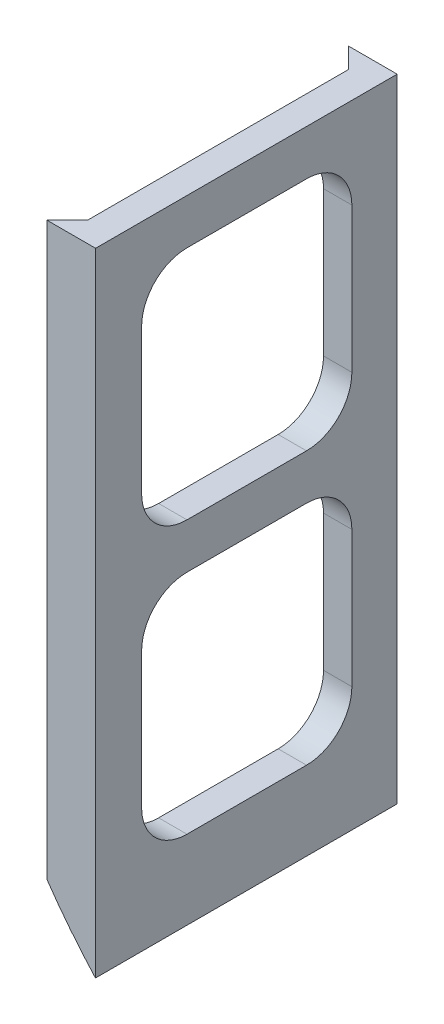
from build123d import *

# Parameters (mm, degrees)
BOSS_EXTRU_1_DEPTH           = 23
BOSS_EXTRU_2_DEPTH           = 55.74
ENL_V_MAT_EXTRU_2_DEPTH      = 166.850257131
ENL_V_MAT_EXTRU_2_DEPTH_BACK = 166.850257131
ENL_V_MAT_EXTRU_3_DEPTH      = 172.327320122
ENL_V_MAT_EXTRU_3_DEPTH_BACK = 172.327320122


with BuildPart() as part:
    # Esquisse1 → Boss.-Extru.1 (new body)
    with BuildSketch(Plane.XY):
        with BuildLine():
            Line((39.457988868, 163.966514235), (39.457988868, 111.179894524))
            ThreePointArc((39.457988868, 111.179894524), (40.679417093, 109.678629524), (41.957988868, 108.225722877))
            Line((41.957988868, 108.225722877), (41.957988868, 163.966514235))
            Line((41.957988868, 163.966514235), (39.457988868, 163.966514235))
        make_face()
    extrude(amount=BOSS_EXTRU_1_DEPTH)

    # Esquisse2 → Boss.-Extru.2 (add)
    with BuildSketch(Plane(origin=(0, 163.966514235, 0), x_dir=(1, 0, 0), z_dir=(0, 1, 0))):
        Polygon((41.957988868, 0), (41.957988868, 1.8), (37.657988868, 1.8), (39.457988868, 0), align=None)
        Polygon((41.957988868, -24.8), (41.957988868, -23), (39.457988868, -23), (37.657988868, -24.8), align=None)
    extrude(amount=-BOSS_EXTRU_2_DEPTH)

    # Esquisse4 → Enlèv. mat.-Extru.2 (cut, two sides: drawn at the far end of the back side and taken through both)
    with BuildSketch(Plane.ZY.offset(-39.457988868).offset(-ENL_V_MAT_EXTRU_2_DEPTH_BACK)):
        with BuildLine():
            Line((6.196124825, 159.966514235), (16.73866324, 159.966514235))
            ThreePointArc((16.73866324, 159.966514235), (19.567090365, 158.79494136), (20.73866324, 155.966514235))
            Line((20.73866324, 155.966514235), (20.73866324, 143.19142939))
            ThreePointArc((20.73866324, 143.19142939), (19.567090365, 140.363002265), (16.73866324, 139.19142939))
            Line((16.73866324, 139.19142939), (6.196124825, 139.19142939))
            ThreePointArc((6.196124825, 139.19142939), (3.367697701, 140.363002265), (2.196124825, 143.19142939))
            Line((2.196124825, 143.19142939), (2.196124825, 155.966514235))
            ThreePointArc((2.196124825, 155.966514235), (3.367697701, 158.79494136), (6.196124825, 159.966514235))
        make_face()
        with BuildLine():
            Line((16.73866324, 135.19142939), (6.196124825, 135.19142939))
            ThreePointArc((6.196124825, 135.19142939), (3.367697701, 134.019856515), (2.196124825, 131.19142939))
            Line((2.196124825, 131.19142939), (2.196124825, 119.179894524))
            ThreePointArc((2.196124825, 119.179894524), (3.367697701, 116.351467399), (6.196124825, 115.179894524))
            Line((6.196124825, 115.179894524), (16.73866324, 115.179894524))
            ThreePointArc((16.73866324, 115.179894524), (19.567090365, 116.351467399), (20.73866324, 119.179894524))
            Line((20.73866324, 119.179894524), (20.73866324, 131.19142939))
            ThreePointArc((20.73866324, 131.19142939), (19.567090365, 134.019856515), (16.73866324, 135.19142939))
        make_face()
    extrude(amount=ENL_V_MAT_EXTRU_2_DEPTH + ENL_V_MAT_EXTRU_2_DEPTH_BACK, mode=Mode.SUBTRACT)

    # Esquisse5 → Enlèv. mat.-Extru.3 (cut, two sides: drawn at the far end of the back side and taken through both)
    with BuildSketch(Plane.XY.offset(24.8).offset(-ENL_V_MAT_EXTRU_3_DEPTH_BACK)):
        with BuildLine():
            Line((35.834434648, 116.483137771), (36.387771846, 105.790873255))
            Line((36.387771846, 105.790873255), (45.050231908, 105.102432834))
            ThreePointArc((45.050231908, 105.102432834), (40.024403512, 110.454356706), (35.834434648, 116.483137771))
        make_face()
    extrude(amount=ENL_V_MAT_EXTRU_3_DEPTH + ENL_V_MAT_EXTRU_3_DEPTH_BACK, mode=Mode.SUBTRACT)


solid = part.part
